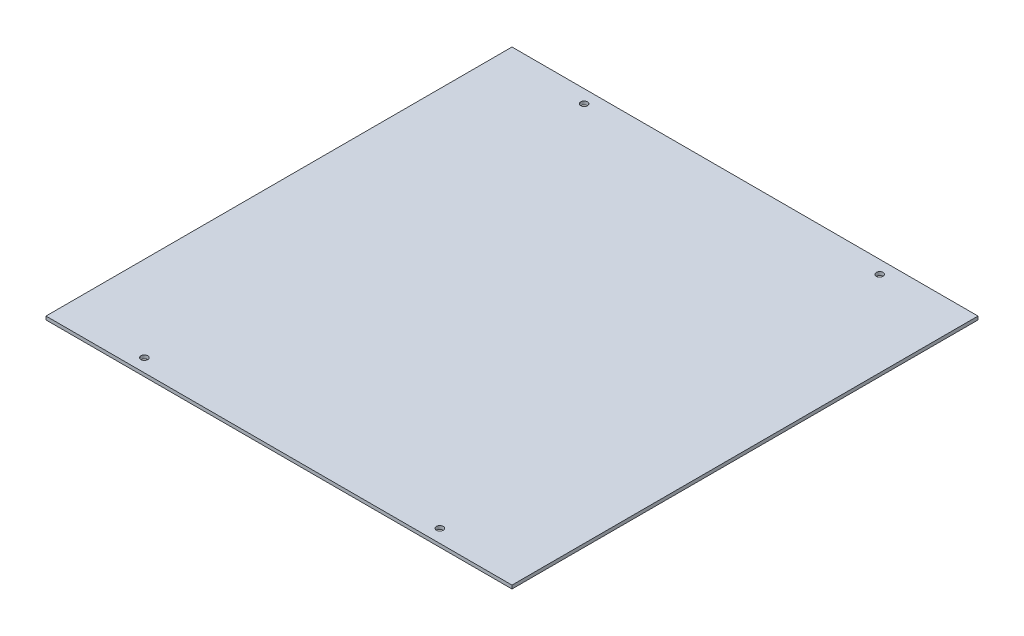
from build123d import *

# Parameters (mm, degrees)
CROQUIS1_W              = 410
CROQUIS1_H              = 410
CROQUIS1_R              = 3
SALIENTE_EXTRUIR1_DEPTH = 3


with BuildPart() as part:
    # Croquis1 → Saliente-Extruir1 (new body)
    with BuildSketch(Plane(origin=(0, 0, 0), x_dir=(1, 0, 0), z_dir=(0, 1, 0))):
        Rectangle(CROQUIS1_W, CROQUIS1_H)
        with Locations(Location((-130, 193.489267674, 0), (0, 0, 270))):
            Circle(CROQUIS1_R, mode=Mode.SUBTRACT)
        with Locations(Location((130, 193.489267674, 0), (0, 0, 90))):
            Circle(CROQUIS1_R, mode=Mode.SUBTRACT)
        with Locations(Location((130, -193.489267674, 0), (0, 0, 270))):
            Circle(CROQUIS1_R, mode=Mode.SUBTRACT)
        with Locations(Location((-130, -193.489267674, 0), (0, 0, 90))):
            Circle(CROQUIS1_R, mode=Mode.SUBTRACT)
    extrude(amount=SALIENTE_EXTRUIR1_DEPTH)


solid = part.part
